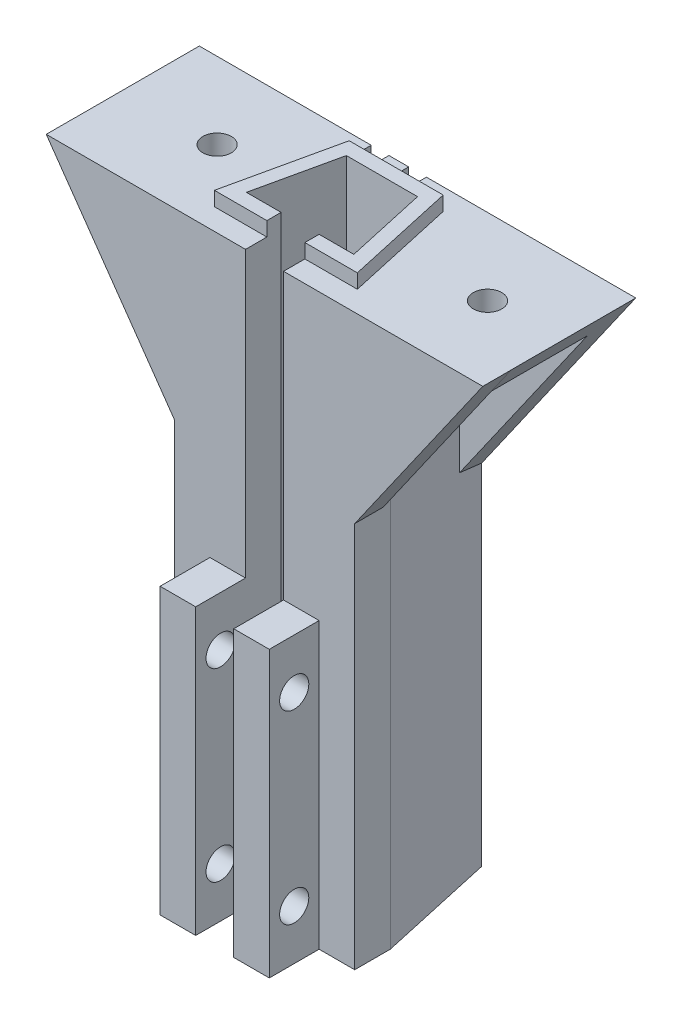
from build123d import *

# Parameters (mm, degrees)
SKETCH2_W           = 5
SKETCH2_H           = 7
BOSS_EXTRUDE1_DEPTH = 40
SKETCH3_R           = 2.05
CUT_EXTRUDE2_DEPTH  = 40
BOSS_EXTRUDE2_DEPTH = 40
SKETCH7_W           = 4.5
SKETCH7_H           = 2
CUT_EXTRUDE3_DEPTH  = 87.11081163
SKETCH8_W           = 1
SKETCH8_H           = 2
CUT_EXTRUDE4_DEPTH  = 5
BOSS_EXTRUDE3_DEPTH = 2
SKETCH10_W          = 2.5
SKETCH10_H          = 2
CUT_EXTRUDE5_DEPTH  = 11
BOSS_EXTRUDE4_DEPTH = 4
BOSS_EXTRUDE7_DEPTH = 4
BOSS_EXTRUDE8_DEPTH = 19
SKETCH17_R          = 2
CUT_EXTRUDE7_DEPTH  = 19
SKETCH18_W          = 2.5
SKETCH18_H          = 2
CUT_EXTRUDE8_DEPTH  = 2.5
SKETCH19_W          = 2.5
SKETCH19_H          = 2
CUT_EXTRUDE9_DEPTH  = 19.5
SKETCH20_W          = 2.3
SKETCH20_H          = 2
CUT_EXTRUDE10_DEPTH = 2.5
SKETCH21_W          = 2.5
SKETCH21_H          = 74.8
CUT_EXTRUDE11_DEPTH = 2.5


with BuildPart() as part:
    # Sketch2 → Boss-Extrude1 (new body)
    with BuildSketch(Plane(origin=(0, 0, 0), x_dir=(1, 0, 0), z_dir=(0, 1, 0))):
        Polygon((11.100217707, -10.156419986), (7.442255773, 6.343580014), (7.442255773, 1.343580014), (3.429331515, 1.343580014), (5.978820135, -10.156419986), align=None)
        Polygon((7.442255773, 6.343580014), (-10.583592744, 6.343580014), (-5.702112708, 5.261381945), (-6.570668485, 1.343580014), (3.429331515, 1.343580014), (2.560775738, 5.261381945), align=None)
        Polygon((-10.583592744, 1.343580014), (-10.583592744, 6.343580014), (-14.241554677, -10.156419986), (-9.120157106, -10.156419986), (-6.570668485, 1.343580014), align=None)
        Polygon((7.442255773, 1.343580014), (7.442255773, 6.343580014), (2.560775738, 5.261381945), (3.429331515, 1.343580014), align=None)
        Polygon((-5.702112708, 5.261381945), (-10.583592744, 6.343580014), (-10.583592744, 1.343580014), (-6.570668485, 1.343580014), align=None)
        Polygon((-9.360074642, -11.238618055), (-14.241554677, -10.156419986), (-14.241554677, -15.156419986), (-9.241554677, -15.156419986), (-4.241554677, -15.156419986), (-4.241554677, -10.156419986), (-9.120157106, -10.156419986), align=None)
        Polygon((-9.120157106, -10.156419986), (-14.241554677, -10.156419986), (-9.360074642, -11.238618055), align=None)
        Polygon((6.218737671, -11.238618055), (11.100217707, -10.156419986), (5.978820135, -10.156419986), align=None)
        Polygon((11.100217707, -15.156419986), (11.100217707, -10.156419986), (6.218737671, -11.238618055), (5.978820135, -10.156419986), (1.100217707, -10.156419986), (1.100217707, -15.156419986), (6.100217707, -15.156419986), align=None)
        with Locations((3.600217707, -18.656419986)):
            Rectangle(SKETCH2_W, SKETCH2_H)
        with Locations((-6.741554677, -18.656419986)):
            Rectangle(SKETCH2_W, SKETCH2_H)
    extrude(amount=BOSS_EXTRUDE1_DEPTH)

    # Sketch3 → Cut-Extrude2 (cut)
    with BuildSketch(Plane.ZY.offset(9.241554677)):
        with Locations((18.656419986, 33)):
            Circle(SKETCH3_R)
        with Locations((18.656419986, 7)):
            Circle(SKETCH3_R)
    extrude(amount=-CUT_EXTRUDE2_DEPTH, mode=Mode.SUBTRACT)

    # Sketch4 → Boss-Extrude2 (add)
    with BuildSketch(Plane(origin=(0, 40, 0), x_dir=(1, 0, 0), z_dir=(0, 1, 0))):
        Polygon((-4.241554677, -10.156419986), (-9.120157106, -10.156419986), (-6.570668485, 1.343580014), (3.429331515, 1.343580014), (5.978820135, -10.156419986), (1.100217707, -10.156419986), (1.100217707, -15.156419986), (6.100217707, -15.156419986), (11.100217707, -15.156419986), (11.100217707, -10.156419986), (7.442255773, 6.343580014), (-10.583592744, 6.343580014), (-14.241554677, -10.156419986), (-14.241554677, -15.156419986), (-9.241554677, -15.156419986), (-4.241554677, -15.156419986), align=None)
    extrude(amount=BOSS_EXTRUDE2_DEPTH)

    # Sketch7 → Cut-Extrude3 (cut, through all)
    with BuildSketch(Plane(origin=(0, 0, -6.343580014), x_dir=(-1, 0, 0), z_dir=(0, 0, -1))):
        with Locations((1.567744227, 4.2)):
            Rectangle(SKETCH7_W, SKETCH7_H)
    extrude(amount=-CUT_EXTRUDE3_DEPTH, mode=Mode.SUBTRACT)

    # Sketch8 → Cut-Extrude4 (cut)
    with BuildSketch(Plane(origin=(0, 0, 10.156419986), x_dir=(-1, 0, 0), z_dir=(0, 0, -1))):
        with Locations((4.741554677, 4.2)):
            Rectangle(SKETCH8_W, SKETCH8_H)
    extrude(amount=-CUT_EXTRUDE4_DEPTH, mode=Mode.SUBTRACT)

    # Sketch9 → Boss-Extrude3 (add)
    with BuildSketch(Plane(origin=(0, 80, 0), x_dir=(1, 0, 0), z_dir=(0, 1, 0))):
        Polygon((1.100217707, -10.156419986), (1.100217707, -12.156419986), (8.470768489, -12.156419986), (5.034501218, 3.343580014), (-8.175838189, 3.343580014), (-11.61210546, -12.156419986), (-4.241554677, -12.156419986), (-4.241554677, -10.156419986), (-9.120157106, -10.156419986), (-6.570668485, 1.343580014), (3.429331515, 1.343580014), (5.978820135, -10.156419986), align=None)
    extrude(amount=BOSS_EXTRUDE3_DEPTH)

    # Sketch10 → Cut-Extrude5 (cut)
    with BuildSketch(Plane(origin=(-5.241554677, 0, 0), x_dir=(0, 0, -1), z_dir=(1, 0, 0))):
        with Locations((-13.906419986, 4.2)):
            Rectangle(SKETCH10_W, SKETCH10_H)
    extrude(amount=-CUT_EXTRUDE5_DEPTH, mode=Mode.SUBTRACT)

    # Sketch11 → Boss-Extrude4 (add)
    with BuildSketch(Plane.XY.offset(15.156419986)):
        Polygon((11.100217707, 54.293335879), (29.100217707, 80), (11.100217707, 80), align=None)
        Polygon((-14.241554677, 54.293335879), (-32.241554677, 80), (-14.241554677, 80), align=None)
    extrude(amount=-BOSS_EXTRUDE4_DEPTH)

    # Sketch15 → Boss-Extrude7 (add)
    with BuildSketch(Plane(origin=(0, 0, -6.343580014), x_dir=(-1, 0, 0), z_dir=(0, 0, -1))):
        Polygon((-7.442255773, 80), (-7.442255773, 49.080595654), (-29.092255773, 80), align=None)
        Polygon((10.583592744, 80), (10.583592744, 49.080595654), (32.233592744, 80), align=None)
    extrude(amount=-BOSS_EXTRUDE7_DEPTH)

    # Sketch16 → Boss-Extrude8 (add)
    with BuildSketch(Plane(origin=(0, 0, -6.343580014), x_dir=(-1, 0, 0), z_dir=(0, 0, -1))):
        Polygon((32.233592744, 80), (29.432762591, 76), (10.233592744, 76), (10.233592744, 80), align=None)
        Polygon((-29.092255773, 80), (-26.29142562, 76), (-7.092255773, 76), (-7.092255773, 80), align=None)
    extrude(amount=-BOSS_EXTRUDE8_DEPTH)

    # Sketch17 → Cut-Extrude7 (cut)
    with BuildSketch(Plane(origin=(0, 76, 0), x_dir=(-1, 0, 0), z_dir=(0, -1, 0))):
        with Locations(Location((-19.01946661, -4.406419986, 0), (0, 0, 90))):
            Circle(SKETCH17_R)
        with Locations(Location((18.980533391, -4.406419986, 0), (0, 0, 90))):
            Circle(SKETCH17_R)
    extrude(amount=-CUT_EXTRUDE7_DEPTH, mode=Mode.SUBTRACT)

    # Sketch18 → Cut-Extrude8 (cut)
    with BuildSketch(Plane.XY.offset(12.656419986)):
        with Locations((-12.991554677, 4.2)):
            Rectangle(SKETCH18_W, SKETCH18_H)
    extrude(amount=-CUT_EXTRUDE8_DEPTH, mode=Mode.SUBTRACT)

    # Sketch19 → Cut-Extrude9 (cut, along a direction that is not the sketch's normal)
    with BuildSketch(Plane.XY.offset(10.156419986)):
        with Locations((-12.991554677, 4.2)):
            Rectangle(SKETCH19_W, SKETCH19_H)
    extrude(amount=-CUT_EXTRUDE9_DEPTH, dir=(-0.2164396139381068, 0, 0.9762960071199325), mode=Mode.SUBTRACT)

    # Sketch20 → Cut-Extrude10 (cut, along a direction that is not the sketch's normal)
    with BuildSketch(Plane(origin=(-9.045364277, 0, -2.005308982), x_dir=(-0.2164396139381068, 0, 0.9762960071199326), z_dir=(-0.9762960071199326, 0, -0.2164396139381068))):
        with Locations((-3.293602146, 4.2)):
            Rectangle(SKETCH20_W, SKETCH20_H)
    extrude(amount=-CUT_EXTRUDE10_DEPTH, dir=(-1, 0, 0), mode=Mode.SUBTRACT)

    # Sketch21 → Cut-Extrude11 (cut)
    with BuildSketch(Plane(origin=(0, 0, -6.343580014), x_dir=(-1, 0, 0), z_dir=(0, 0, -1))):
        with Locations((1.567744227, 42.6)):
            Rectangle(SKETCH21_W, SKETCH21_H)
        with Locations((6.833592744, 42.6)):
            Rectangle(SKETCH21_W, SKETCH21_H)
    extrude(amount=-CUT_EXTRUDE11_DEPTH, mode=Mode.SUBTRACT)


solid = part.part
